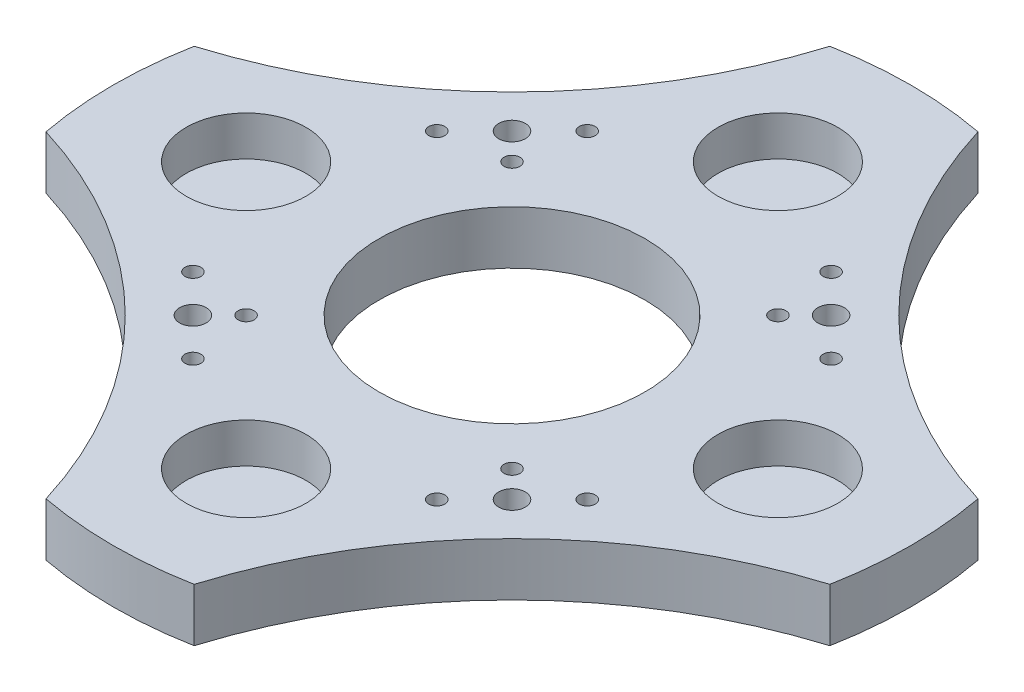
from build123d import *

# Parameters (mm, degrees)
SKETCH1_R           = 75
BOSS_EXTRUDE1_DEPTH = 10
SKETCH4_R           = 90
CUT_EXTRUDE2_DEPTH  = 10
SKETCH5_R           = 2.5
SKETCH5_R_2         = 25
SKETCH5_R_3         = 1.5
CUT_EXTRUDE3_DEPTH  = 10
SKETCH6_R           = 1.5
CUT_EXTRUDE4_DEPTH  = 10
SKETCH8_R           = 11.25
CUT_EXTRUDE5_DEPTH  = 7.5


with BuildPart() as part:
    # Sketch1 → Boss-Extrude1 (new body)
    with BuildSketch(Plane(origin=(0, 0, 0), x_dir=(1, 0, 0), z_dir=(0, 1, 0))):
        Circle(SKETCH1_R)
    extrude(amount=BOSS_EXTRUDE1_DEPTH)

    # Sketch4 → Cut-Extrude2 (cut)
    with BuildSketch(Plane(origin=(0, 10, 0), x_dir=(1, 0, 0), z_dir=(0, 1, 0))):
        with Locations((-100, 100)):
            Circle(SKETCH4_R)
        with Locations((100, 100)):
            Circle(SKETCH4_R)
        with Locations((100, -100)):
            Circle(SKETCH4_R)
        with Locations((-100, -100)):
            Circle(SKETCH4_R)
    extrude(amount=-CUT_EXTRUDE2_DEPTH, mode=Mode.SUBTRACT)

    # Sketch5 → Cut-Extrude3 (cut)
    with BuildSketch(Plane(origin=(0, 10, 0), x_dir=(1, 0, 0), z_dir=(0, 1, 0))):
        with Locations((-30, 30)):
            Circle(SKETCH5_R)
        with Locations((30, 30)):
            Circle(SKETCH5_R)
        with Locations((30, -30)):
            Circle(SKETCH5_R)
        with Locations((-30, -30)):
            Circle(SKETCH5_R)
        Circle(SKETCH5_R_2)
        with Locations((-37.071067812, -22.928932188)):
            Circle(SKETCH5_R_3)
        with Locations((-22.928932188, -37.071067812)):
            Circle(SKETCH5_R_3)
        with Locations((22.928932188, -37.071067812)):
            Circle(SKETCH5_R_3)
        with Locations((37.071067812, -22.928932188)):
            Circle(SKETCH5_R_3)
        with Locations((37.071067812, 22.928932188)):
            Circle(SKETCH5_R_3)
        with Locations((22.928932188, 37.071067812)):
            Circle(SKETCH5_R_3)
        with Locations((-22.928932188, 37.071067812)):
            Circle(SKETCH5_R_3)
        with Locations((-37.071067812, 22.928932188)):
            Circle(SKETCH5_R_3)
    extrude(amount=-CUT_EXTRUDE3_DEPTH, mode=Mode.SUBTRACT)

    # Sketch6 → Cut-Extrude4 (cut)
    with BuildSketch(Plane(origin=(0, 10, 0), x_dir=(1, 0, 0), z_dir=(0, 1, 0))):
        with Locations((-25, 25)):
            Circle(SKETCH6_R)
        with Locations((25, 25)):
            Circle(SKETCH6_R)
        with Locations((25, -25)):
            Circle(SKETCH6_R)
        with Locations((-25, -25)):
            Circle(SKETCH6_R)
    extrude(amount=-CUT_EXTRUDE4_DEPTH, mode=Mode.SUBTRACT)

    # Sketch8 → Cut-Extrude5 (cut)
    with BuildSketch(Plane(origin=(0, 10, 0), x_dir=(1, 0, 0), z_dir=(0, 1, 0))):
        with Locations((-50, 0)):
            Circle(SKETCH8_R)
        with Locations((0, 50)):
            Circle(SKETCH8_R)
        with Locations((50, 0)):
            Circle(SKETCH8_R)
        with Locations((0, -50)):
            Circle(SKETCH8_R)
    extrude(amount=-CUT_EXTRUDE5_DEPTH, mode=Mode.SUBTRACT)


solid = part.part
